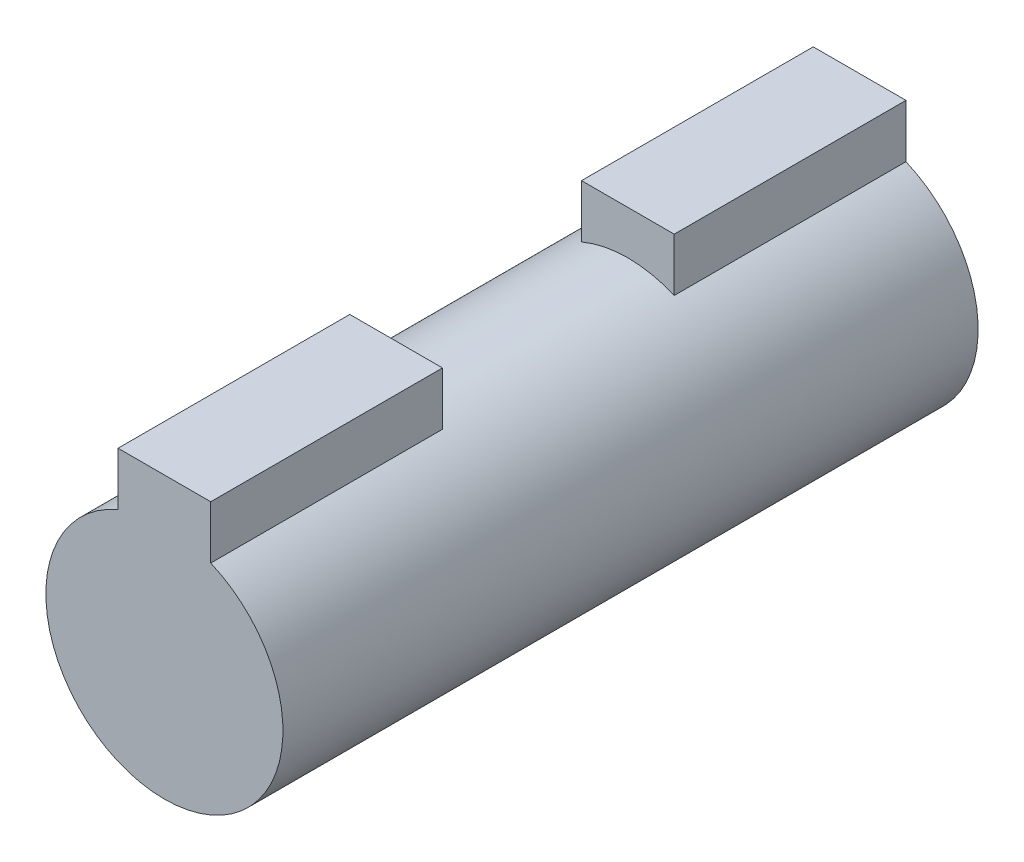
from build123d import *

# Parameters (mm, degrees)
BOSS_EXTRUDE1_DEPTH = 30
CUT_EXTRUDE3_START  = -20
SKETCH2_R           = 7.632240199
SKETCH2_R_2         = 5.115
CUT_EXTRUDE3_DEPTH  = 10


with BuildPart() as part:
    # Sketch1 → Boss-Extrude1 (new body)
    with BuildSketch(Plane.XY):
        with BuildLine():
            Line((-2, 7), (2, 7))
            Line((2, 7), (2, 4.707783449))
            ThreePointArc((2, 4.707783449), (0, -5.115), (-2, 4.707783449))
            Line((-2, 4.707783449), (-2, 7))
        make_face()
    extrude(amount=BOSS_EXTRUDE1_DEPTH)

    # Sketch2 → Cut-Extrude3 (cut)
    with BuildSketch(Plane.XY.offset(30).offset(CUT_EXTRUDE3_START)):
        Circle(SKETCH2_R)
        with Locations(Location((0, 0, 0), (0, 0, 113.017162604))):
            Circle(SKETCH2_R_2, mode=Mode.SUBTRACT)
    extrude(amount=CUT_EXTRUDE3_DEPTH, mode=Mode.SUBTRACT)


solid = part.part
